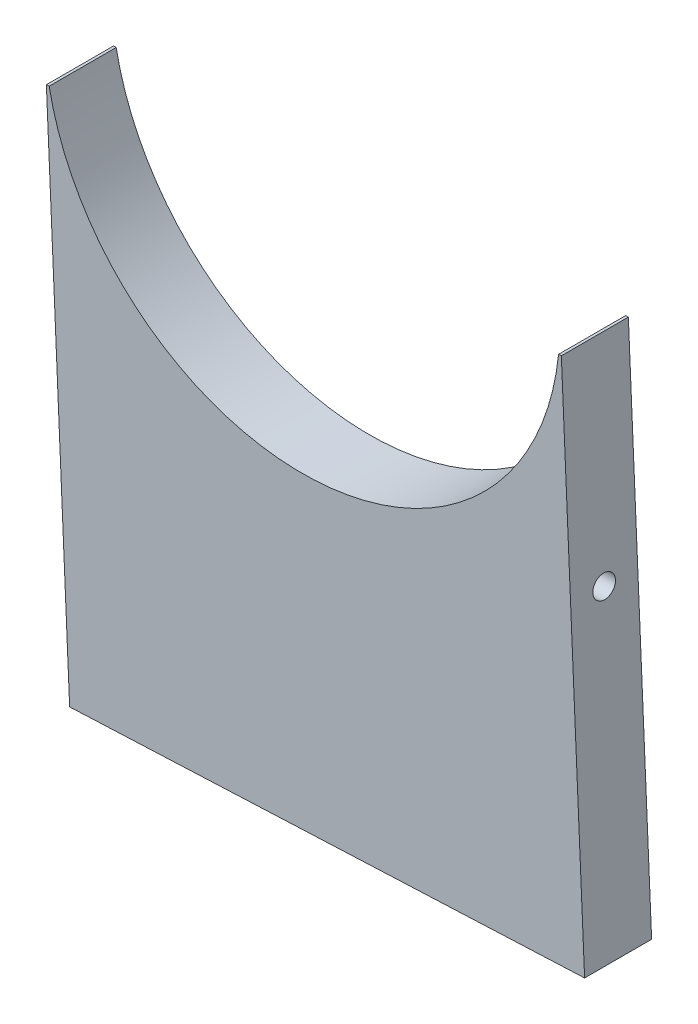
from build123d import *

# Parameters (mm, degrees)
BOSS_EXTRUDE1_DEPTH                       = 17.78
SKETCH3_R                                 = 3
CUT_EXTRUDE3_DEPTH                        = 6
CUT_EXTRUDE4_START                        = -6
SKETCH4_R                                 = 3
CUT_EXTRUDE4_DEPTH                        = 6
TAP_DRILL_FOR_M4X0_7_TAP1_D               = 3.3
TAP_DRILL_FOR_M4X0_7_TAP1_DEPTH           = 10
TAP_DRILL_FOR_M4X0_7_TAP1_TIP             = 0.991420021
TAP_DRILL_FOR_M4X0_7_TAP1_ON_FACE_2_D     = 3.3
TAP_DRILL_FOR_M4X0_7_TAP1_ON_FACE_2_DEPTH = 10
TAP_DRILL_FOR_M4X0_7_TAP1_ON_FACE_2_TIP   = 0.991420021


with BuildPart() as part:
    # Sketch1 → Boss-Extrude1 (new body)
    with BuildSketch(Plane(origin=(0, 0, 0), x_dir=(-0.044080076933776656, 0.9990280010177455, 0), z_dir=(0, 0, 1))):
        with BuildLine():
            Line((-5.997717637, -62.816664904), (-5.997717637, -63.551933441))
            Line((-5.997717637, -63.551933441), (-145.997717637, -63.551933441))
            Line((-145.997717637, -63.551933441), (-145.997717637, 73.188066556))
            Line((-145.997717637, 73.188066556), (-5.997717637, 73.188066556))
            Line((-5.997717637, 73.188066556), (-5.997717637, 72.452798018))
            ThreePointArc((-5.997717637, 72.452798018), (-64.367717636, 4.818066557), (-5.997717637, -62.816664904))
        make_face()
    extrude(amount=BOSS_EXTRUDE1_DEPTH)

    # Sketch3 → Cut-Extrude3 (cut)
    with BuildSketch(Plane(origin=(-73.116927829, -3.226135604, 0), x_dir=(0, 0, 1), z_dir=(-0.9990280010177455, -0.044080076933776635, 0))):
        with Locations(Location((8.89, -62.227710676, 0), (0, 0, 270))):
            Circle(SKETCH3_R)
    extrude(amount=-CUT_EXTRUDE3_DEPTH, mode=Mode.SUBTRACT)

    # Sketch4 → Cut-Extrude4 (cut)
    with BuildSketch(Plane(origin=(63.490161027, 2.801374115, 0), x_dir=(0, 0, -1), z_dir=(0.9990280010177455, 0.044080076933776635, 0)).offset(CUT_EXTRUDE4_START)):
        with Locations(Location((-8.89, -62.227710676, 0), (0, 0, 270))):
            Circle(SKETCH4_R)
    extrude(amount=CUT_EXTRUDE4_DEPTH, mode=Mode.SUBTRACT)

    # Tap Drill for M4x0.7 Tap1
    with Locations(Plane(origin=(-32.52956499, -147.575066179, 8.89), x_dir=(-0.999028001018, -0.044080076934, 0), z_dir=(0.044080076934, -0.999028001018, 0))):
        with Locations((0, 0)):
            Hole(TAP_DRILL_FOR_M4X0_7_TAP1_D / 2, depth=TAP_DRILL_FOR_M4X0_7_TAP1_DEPTH)
            with Locations((0, 0, -(TAP_DRILL_FOR_M4X0_7_TAP1_DEPTH + TAP_DRILL_FOR_M4X0_7_TAP1_TIP / 2))):  # 118° drill point
                Cone(0, TAP_DRILL_FOR_M4X0_7_TAP1_D / 2, TAP_DRILL_FOR_M4X0_7_TAP1_TIP, mode=Mode.SUBTRACT)

    # Tap Drill for M4x0.7 Tap1 on face 2
    with Locations(Plane(origin=(35.773979438, -144.561311319, 8.89), x_dir=(-0.999028004404, -0.044080000194, 0), z_dir=(0.044080000194, -0.999028004404, 0))):
        with Locations((0, 0)):
            Hole(TAP_DRILL_FOR_M4X0_7_TAP1_ON_FACE_2_D / 2, depth=TAP_DRILL_FOR_M4X0_7_TAP1_ON_FACE_2_DEPTH)
            with Locations((0, 0, -(TAP_DRILL_FOR_M4X0_7_TAP1_ON_FACE_2_DEPTH + TAP_DRILL_FOR_M4X0_7_TAP1_ON_FACE_2_TIP / 2))):  # 118° drill point
                Cone(0, TAP_DRILL_FOR_M4X0_7_TAP1_ON_FACE_2_D / 2, TAP_DRILL_FOR_M4X0_7_TAP1_ON_FACE_2_TIP, mode=Mode.SUBTRACT)


solid = part.part
